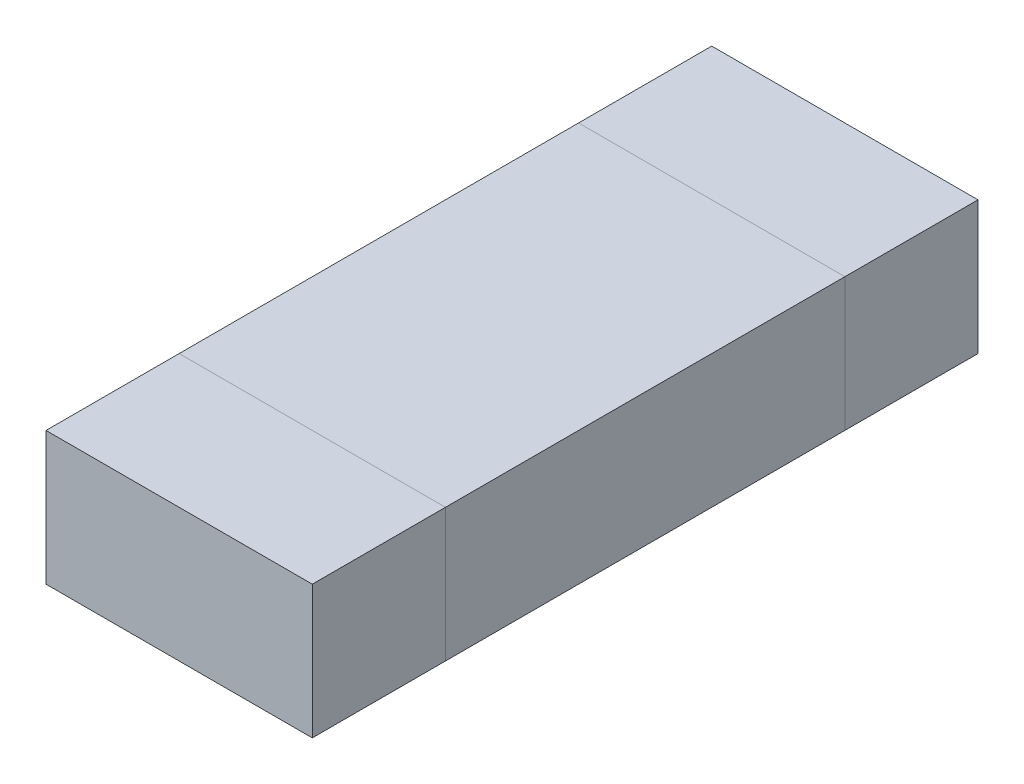
from build123d import *

# Parameters (mm, degrees)
SKETCH1_W  = 0.8
SKETCH1_H  = 1.2
MB_DEPTH   = 0.4
SKETCH2_W  = 0.8
SKETCH2_H  = 0.4
SB_L_DEPTH = 0.4
SKETCH3_W  = 0.8
SKETCH3_H  = 0.4
SB_R_DEPTH = 0.4


with BuildPart() as part:
    # Sketch1 → MB (new body)
    with BuildSketch(Plane(origin=(0, 0, 0), x_dir=(1, 0, 0), z_dir=(0, 1, 0))):
        Rectangle(SKETCH1_W, SKETCH1_H)
    extrude(amount=MB_DEPTH)


with BuildPart() as body_2:
    # Sketch2 → SB L (new body)
    with BuildSketch(Plane.XY.offset(0.6)):
        with Locations((0, 0.2)):
            Rectangle(SKETCH2_W, SKETCH2_H)
    extrude(amount=SB_L_DEPTH)


with BuildPart() as body_3:
    # Sketch3 → SB R (new body)
    with BuildSketch(Plane(origin=(0, 0, -0.6), x_dir=(-1, 0, 0), z_dir=(0, 0, -1))):
        with Locations((0, 0.2)):
            Rectangle(SKETCH3_W, SKETCH3_H)
    extrude(amount=SB_R_DEPTH)


solid = Compound([part.part, body_2.part, body_3.part])
